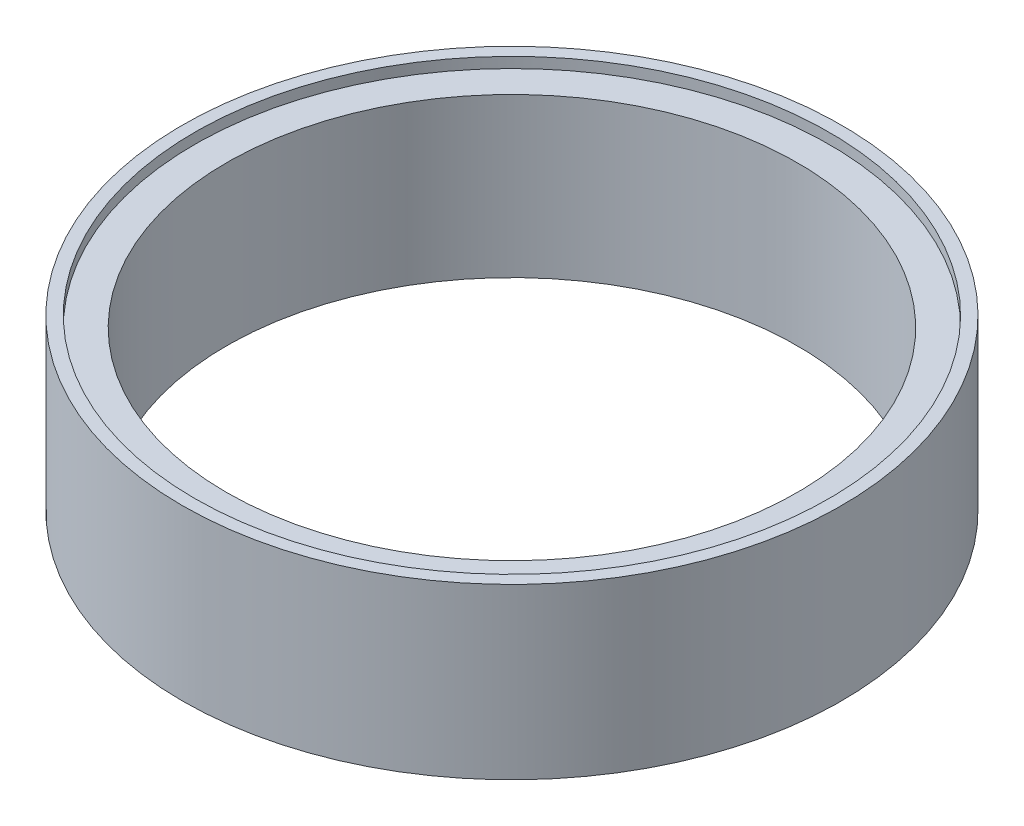
from build123d import *

# Parameters (mm, degrees)
SKETCH1_R               = 9.35
BOSS_EXTRUDE1_DEPTH     = 4.8
CUT_EXTRUDE1_DEPTH      = 15.067160339
CUT_EXTRUDE1_DEPTH_BACK = 15.067160339
SKETCH2_R               = 8.1
SKETCH3_R               = 9
CUT_EXTRUDE2_DEPTH      = 0.3


with BuildPart() as part:
    # Sketch1 → Boss-Extrude1 (new body)
    with BuildSketch(Plane(origin=(0, 0, 0), x_dir=(1, 0, 0), z_dir=(0, 1, 0))):
        with Locations(Location((0, 0, 0), (0, 0, 270))):
            Circle(SKETCH1_R)
    extrude(amount=BOSS_EXTRUDE1_DEPTH)

    # Sketch2 → Cut-Extrude1 (cut, two sides: drawn at the far end of the back side and taken through both)
    with BuildSketch(Plane(origin=(0, 4.8, 0), x_dir=(1, 0, 0), z_dir=(0, 1, 0)).offset(-CUT_EXTRUDE1_DEPTH_BACK)):
        with Locations(Location((0, 0, 0), (0, 0, 270))):
            Circle(SKETCH2_R)
    extrude(amount=CUT_EXTRUDE1_DEPTH + CUT_EXTRUDE1_DEPTH_BACK, mode=Mode.SUBTRACT)

    # Sketch3 → Cut-Extrude2 (cut)
    with BuildSketch(Plane(origin=(0, 4.8, 0), x_dir=(1, 0, 0), z_dir=(0, 1, 0))):
        with Locations(Location((0, 0, 0), (0, 0, 270))):
            Circle(SKETCH3_R)
    extrude(amount=-CUT_EXTRUDE2_DEPTH, mode=Mode.SUBTRACT)


solid = part.part
